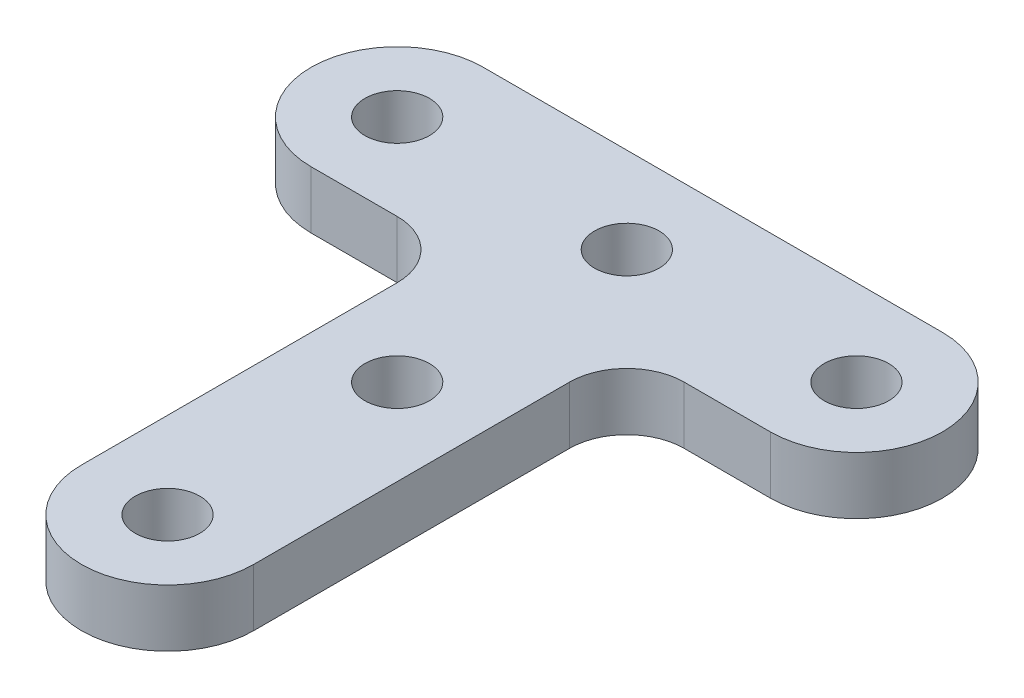
from build123d import *

# Parameters (mm, degrees)
BOSS_EXTRUDE1_START     = 12.827
BOSS_EXTRUDE1_DEPTH     = 6.35
FILLET1_R               = 6.35
F_1_4_CLEARANCE_HOLE1_D = 7.14248


with BuildPart() as part:
    # Sketch1 → Boss-Extrude1 (new body)
    with BuildSketch(Plane(origin=(0, 144.904574554, 0), x_dir=(-1, 0, 0), z_dir=(0, -1, 0)).offset(BOSS_EXTRUDE1_START)):
        with BuildLine():
            Line((-24.961912484, -1122.100334154), (-9.086912484, -1122.100334154))
            Line((-9.086912484, -1122.100334154), (-9.086912484, -1163.375334154))
            ThreePointArc((-9.086912484, -1163.375334154), (0.438087516, -1172.900334154), (9.963087516, -1163.375334154))
            Line((9.963087516, -1163.375334154), (9.963087516, -1122.100334154))
            Line((9.963087516, -1122.100334154), (25.838087516, -1122.100334154))
            ThreePointArc((25.838087516, -1122.100334154), (35.363087516, -1112.575334154), (25.838087516, -1103.050334154))
            Line((25.838087516, -1103.050334154), (-24.961912484, -1103.050334154))
            ThreePointArc((-24.961912484, -1103.050334154), (-34.486912484, -1112.575334154), (-24.961912484, -1122.100334154))
        make_face()
    extrude(amount=BOSS_EXTRUDE1_DEPTH)

    # Fillet1
    fillet1_edges = [part.edges().sort_by_distance(p)[0] for p in [
        (-9.963087516, 128.902574554, 1122.100334154),
        (9.086912484, 128.902574554, 1122.100334154),
    ]]
    fillet(fillet1_edges, radius=FILLET1_R)

    # 1/4 Clearance Hole1 (through all)
    with Locations(Plane(origin=(0, 125.727574554, 0), x_dir=(-1, 0, 0), z_dir=(0, -1, 0))):
        with Locations((-24.961912484, -1112.575334154), (25.838087516, -1112.575334154), (0.438087516, -1137.975334154), (0.438087516, -1163.375334154), (0.438087516, -1112.575334154)):
            Hole(F_1_4_CLEARANCE_HOLE1_D / 2)


solid = part.part
